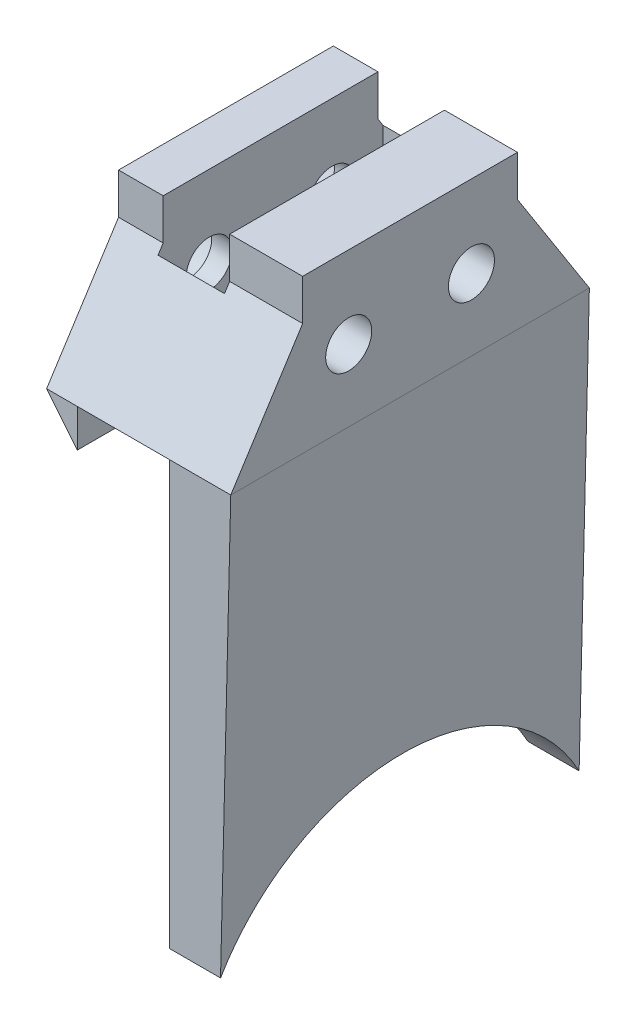
from build123d import *

# Parameters (mm, degrees)
GRIPPER_ATTACHMENT_BASE_SKETCH_W   = 12
GRIPPER_ATTACHMENT_BASE_SKETCH_H   = 15
GRIPPER_ATTACHMENT_BASE_DEPTH      = 35.0588586
THICKENER_BASE_DEPTH               = 6
THICKNESS_CUTOFF_SKETCH_W          = 55.0588586
THICKNESS_CUTOFF_SKETCH_H          = 76.379477122
THICKNESS_CUTOFF_DEPTH             = 63.622352222
EXCESS_MATERIAL_CUTOFF_DEPTH       = 530.479784495
EXCESS_MATERIAL_CUTOFF_DEPTH_BACK  = 530.479784495
FINGER_CAVITY_CUTOUT_SKETCH_W      = 6.5
FINGER_CAVITY_CUTOUT_SKETCH_H      = 22
FINGER_CAVITY_CUTOUT_DEPTH         = 15
SCREW_THROUGH_HOLES_SKETCH_R       = 2.25
SCREW_THROUGH_HOLES_DEPTH          = 63.800756824
SOCKET_RECESSES_SKETCH_R           = 3.75
SOCKET_RECESSES_DEPTH              = 2.3625
SHAPING_TO_ELECTRONICS_PLATE_DEPTH = 35.058859


with BuildPart() as part:
    # Gripper Attachment Base Sketch → Gripper Attachment Base (new body)
    with BuildSketch(Plane.XY):
        Rectangle(GRIPPER_ATTACHMENT_BASE_SKETCH_W, GRIPPER_ATTACHMENT_BASE_SKETCH_H)
    extrude(amount=GRIPPER_ATTACHMENT_BASE_DEPTH)

    # Thickener Base Sketch → Thickener Base (add)
    with BuildSketch(Plane(origin=(6, 0, 0), x_dir=(0, 0, -1), z_dir=(1, 0, 0))):
        with BuildLine():
            Line((0, 7.5), (-35.0588586, 7.5))
            Line((-35.0588586, 7.5), (-35.0588586, -48.8959251))
            ThreePointArc((-35.0588586, -48.8959251), (-17.5294293, -38.525001297), (0, -48.8959251))
            Line((0, -48.8959251), (0, 7.5))
        make_face()
    extrude(amount=THICKENER_BASE_DEPTH)

    # Thickness Cutoff Sketch → Thickness Cutoff (cut, through all)
    with BuildSketch(Plane(origin=(12.174072963, -0.29408868, 0), x_dir=(0, 0, -1), z_dir=(0.9997083481115524, -0.02414992165766464, 0))):
        with Locations((-17.5294293, -20.40212689)):
            Rectangle(THICKNESS_CUTOFF_SKETCH_W, THICKNESS_CUTOFF_SKETCH_H)
    extrude(amount=THICKNESS_CUTOFF_DEPTH, mode=Mode.SUBTRACT)

    # Excess Material Cutoff Sketch → Excess Material Cutoff (cut, two sides: drawn at the far end of the back side and taken through both)
    with BuildSketch(Plane(origin=(0, -520.681520523, 0), x_dir=(0, 0, 1), z_dir=(1, 0, 0)).offset(-EXCESS_MATERIAL_CUTOFF_DEPTH_BACK)):
        Polygon((7.0294293, -528.181520523), (0, -528.181520523), (0, -513.181520523), (7.0294293, -524.181520523), align=None)
        Polygon((28.0294293, -528.181520523), (35.0588586, -528.181520523), (35.0588586, -513.181520523), (28.0294293, -524.181520523), align=None)
    extrude(amount=EXCESS_MATERIAL_CUTOFF_DEPTH + EXCESS_MATERIAL_CUTOFF_DEPTH_BACK, mode=Mode.SUBTRACT)

    # Finger Cavity Cutout Sketch → Finger Cavity Cutout (cut)
    with BuildSketch(Plane(origin=(0, 7.5, 0), x_dir=(1, 0, 0), z_dir=(0, 1, 0))):
        with Locations((1.6125, -17.5294293)):
            Rectangle(FINGER_CAVITY_CUTOUT_SKETCH_W, FINGER_CAVITY_CUTOUT_SKETCH_H)
    extrude(amount=-FINGER_CAVITY_CUTOUT_DEPTH, mode=Mode.SUBTRACT)

    # Screw Through-Holes Sketch → Screw Through-Holes (cut, through all)
    with BuildSketch(Plane.ZY.offset(6)):
        with Locations(Location((11.5294293, -0.5, 0), (0, 0, 270))):
            Circle(SCREW_THROUGH_HOLES_SKETCH_R)
        with Locations(Location((23.5294293, -0.5, 0), (0, 0, 270))):
            Circle(SCREW_THROUGH_HOLES_SKETCH_R)
    extrude(amount=-SCREW_THROUGH_HOLES_DEPTH, mode=Mode.SUBTRACT)

    # Socket Recesses Sketch → Socket Recesses (cut)
    with BuildSketch(Plane.ZY.offset(6)):
        with Locations(Location((11.5294293, -0.5, 0), (0, 0, 270))):
            Circle(SOCKET_RECESSES_SKETCH_R)
        with Locations(Location((23.5294293, -0.5, 0), (0, 0, 270))):
            Circle(SOCKET_RECESSES_SKETCH_R)
    extrude(amount=-SOCKET_RECESSES_DEPTH, mode=Mode.SUBTRACT)

    # Shaping to Electronics Plate Sketch → Shaping to Electronics Plate (add, through all)
    with BuildSketch(Plane.XY):
        Polygon((-6, -7.5), (-3, -11.2), (-3, -7.5), align=None)
    extrude(amount=SHAPING_TO_ELECTRONICS_PLATE_DEPTH)


solid = part.part
